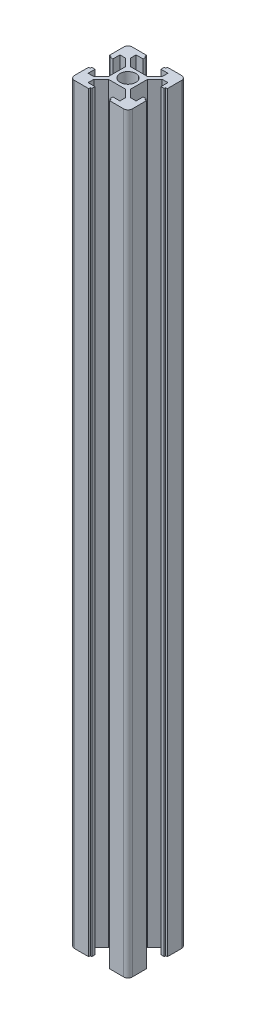
from build123d import *

# Parameters (mm, degrees)
SKETCH_1_W               = 20
SKETCH_1_H               = 20
EXTRUDE_1_DEPTH          = 130
SKETCH_4_R               = 2.7
CUT_EXTRUDE_3_DEPTH      = 9999
SKETCH_2_W               = 7.2
SKETCH_2_H               = 1.2
SKETCH_2_W_2             = 6.2
SKETCH_2_H_2             = 3.4
CUT_EXTRUDE_1_DEPTH      = 9999
CUT_EXTRUDE_2_DEPTH      = 9999
PATTERN_CIRCULAR_5_COUNT = 4
FILLET_1_R               = 1.5


with BuildPart() as part:
    # 草图1 → 凸台-拉伸1 (new, symmetric)
    with BuildSketch(Plane(origin=(0, 0, 0), x_dir=(1, 0, 0), z_dir=(0, 1, 0))):
        Rectangle(SKETCH_1_W, SKETCH_1_H)
    extrude(amount=EXTRUDE_1_DEPTH, both=True)

    # 草图4 → 切除-拉伸3 (cut)
    with BuildSketch(Plane(origin=(0, 130, 0), x_dir=(1, 0, 0), z_dir=(0, 1, 0))):
        with Locations(Location((0, 0, 0), (0, 0, 270))):
            Circle(SKETCH_4_R)
    extrude(amount=-CUT_EXTRUDE_3_DEPTH, mode=Mode.SUBTRACT)

    # 草图2 → 切除-拉伸1 (cut)
    with BuildSketch(Plane(origin=(0, 130, 0), x_dir=(1, 0, 0), z_dir=(0, 1, 0))):
        with Locations((0, 10)):
            Rectangle(SKETCH_2_W, SKETCH_2_H)
        with Locations((0, 10)):
            Rectangle(SKETCH_2_W_2, SKETCH_2_H_2)
    cut_extrude_1 = extrude(amount=-CUT_EXTRUDE_1_DEPTH, mode=Mode.SUBTRACT)

    # 草图3 → 切除-拉伸2 (cut)
    with BuildSketch(Plane(origin=(0, 130, 0), x_dir=(1, 0, 0), z_dir=(0, 1, 0))):
        Polygon((5.5, 8.3), (-5.5, 8.3), (-5.5, 6.3), (-3, 3.8), (3, 3.8), (5.5, 6.3), align=None)
    cut_extrude_2 = extrude(amount=-CUT_EXTRUDE_2_DEPTH, mode=Mode.SUBTRACT)

    # 阵列(圆周)5: 切除-拉伸1, 切除-拉伸2 ×4 about axis
    pattern_circular_5_axis = Axis((0, 0, 0), (0, 1, 0))
    add([cut_extrude_1.rotate(pattern_circular_5_axis, i * 360 / PATTERN_CIRCULAR_5_COUNT) for i in range(1, PATTERN_CIRCULAR_5_COUNT)], mode=Mode.SUBTRACT)
    add([cut_extrude_2.rotate(pattern_circular_5_axis, i * 360 / PATTERN_CIRCULAR_5_COUNT) for i in range(1, PATTERN_CIRCULAR_5_COUNT)], mode=Mode.SUBTRACT)

    # 圆角1
    fillet_1_edges = [part.edges().sort_by_distance(p)[0] for p in [
        (10, 0, 10),
        (-10, 0, 10),
        (-10, 0, -10),
        (10, 0, -10),
    ]]
    fillet(fillet_1_edges, radius=FILLET_1_R)


solid = part.part
